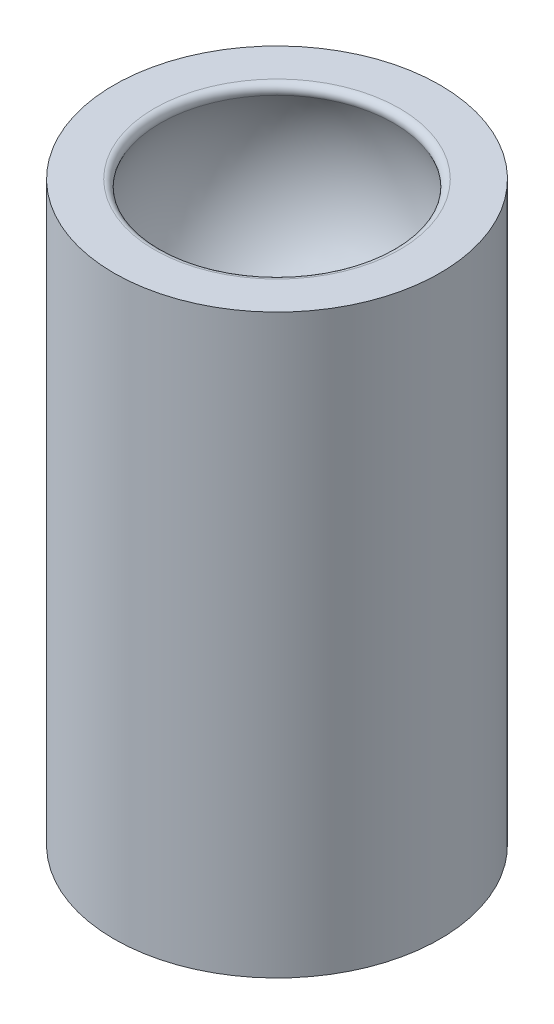
from build123d import *

# Parameters (mm, degrees)
SKETCH1_R           = 4.875
SKETCH1_R_2         = 2.375
BOSS_EXTRUDE1_DEPTH = 17.25
FILLET1_R           = 0.2


with BuildPart() as part:
    # Sketch1 → Boss-Extrude1 (new body)
    with BuildSketch(Plane(origin=(0, 0, 0), x_dir=(1, 0, 0), z_dir=(0, 1, 0))):
        with Locations(Location((0, 0, 0), (0, 0, 270))):
            Circle(SKETCH1_R)
        with Locations(Location((0, 0, 0), (0, 0, 270))):
            Circle(SKETCH1_R_2, mode=Mode.SUBTRACT)
    extrude(amount=BOSS_EXTRUDE1_DEPTH)

    # Sketch3 → Cut-Revolve3 (revolve, cut)
    with BuildSketch(Plane(origin=(0, 15, 0), x_dir=(-1, 0, 0), z_dir=(0, -1, 0))):
        with BuildLine():
            Line((0, 4), (0, -4))
            ThreePointArc((0, -4), (4, 0), (0, 4))
        make_face()
    revolve(axis=Axis((0, 15, -5.147727802), (0, 0, 1)), mode=Mode.SUBTRACT)

    # Fillet1
    fillet1_edges = [part.edges().sort_by_distance(p)[0] for p in [
        (0, 17.25, -3.307189139),
    ]]
    fillet(fillet1_edges, radius=FILLET1_R)


solid = part.part
